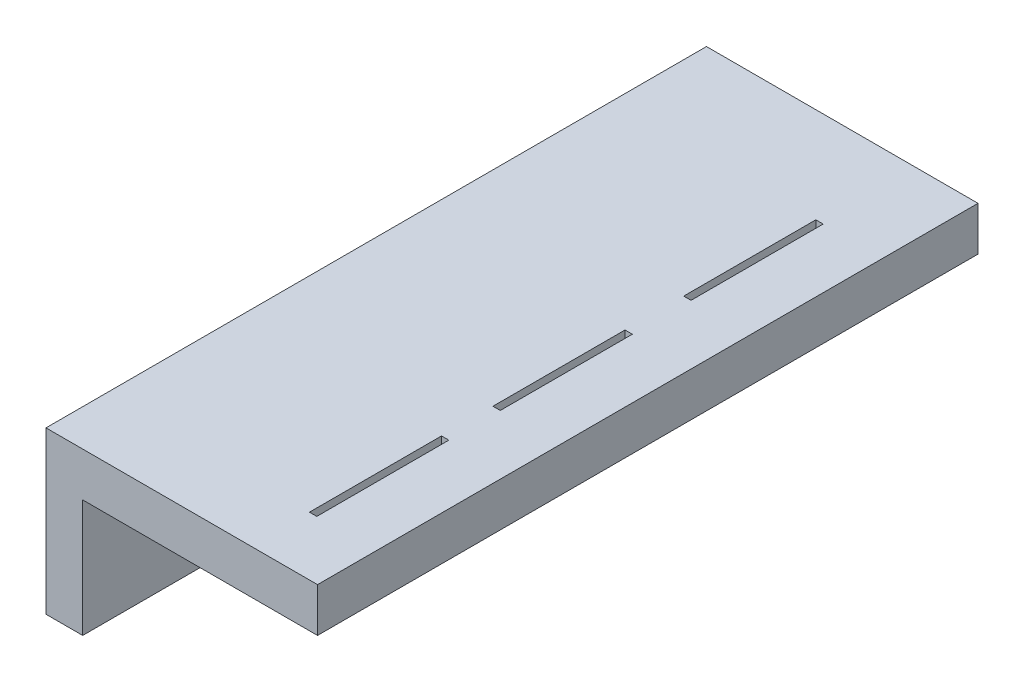
from build123d import *

# Parameters (mm, degrees)
SKETCH1_W               = 70.4
SKETCH1_H               = 2
BOSS_EXTRUDE2_DEPTH     = 10
SKETCH2_W               = 2
SKETCH2_H               = 55
BOSS_EXTRUDE3_DEPTH     = 10
SKETCH3_W               = 19
SKETCH3_H               = 3
BOSS_EXTRUDE4_DEPTH     = 2
SKETCH4_W               = 15
SKETCH4_H               = 10
CUT_EXTRUDE2_DEPTH      = 2
SKETCH5_W               = 2
SKETCH5_H               = 3
BOSS_EXTRUDE5_DEPTH     = 1
SKETCH6_W               = 2
SKETCH6_H               = 3
BOSS_EXTRUDE6_DEPTH     = 1
SKETCH7_W               = 57
SKETCH7_H               = 2
BOSS_EXTRUDE7_DEPTH     = 6.6
SKETCH8_W               = 57
SKETCH8_H               = 2
BOSS_EXTRUDE8_DEPTH     = 6.6
BOSS_EXTRUDE9_DEPTH     = 5
SKETCH12_W              = 2
SKETCH12_H              = 5
SKETCH12_H_2            = 40
SKETCH12_H_3            = 30
BOSS_EXTRUDE10_DEPTH    = 20
BOSS_EXTRUDE11_DEPTH    = 3
SKETCH14_W              = 0.5
SKETCH14_H              = 9
CUT_EXTRUDE3_DEPTH      = 3
SKETCH15_W              = 38.4
SKETCH15_H              = 45
CUT_EXTRUDE4_DEPTH      = 3
BOSS_EXTRUDE12_DEPTH    = 0.5
SKETCH17_R              = 1.8
SKETCH17_W              = 3
SKETCH17_H              = 5
CUT_EXTRUDE6_DEPTH      = 3
CUT_EXTRUDE8_DEPTH      = 32
CUT_EXTRUDE8_DEPTH_BACK = 49
SKETCH19_W              = 94.558020587
SKETCH19_H              = 51.225034616
CUT_EXTRUDE9_DEPTH      = 93
CUT_EXTRUDE9_DEPTH_BACK = 18
SKETCH20_W              = 91.945359737
SKETCH20_H              = 40.424662202
SKETCH21_W              = 45
SKETCH21_H              = 3
BOSS_EXTRUDE14_DEPTH    = 2.5
SKETCH22_W              = 2.5
SKETCH22_H              = 45
BOSS_EXTRUDE15_DEPTH    = 8
SKETCH23_R              = 1.8
CUT_EXTRUDE10_DEPTH     = 10


with BuildPart() as part:
    # Sketch1 → Boss-Extrude2 (new body)
    with BuildSketch(Plane(origin=(0, 0, 0), x_dir=(1, 0, 0), z_dir=(0, 1, 0))):
        with Locations((35.2, 1)):
            Rectangle(SKETCH1_W, SKETCH1_H)
    extrude(amount=BOSS_EXTRUDE2_DEPTH)

    # Sketch2 → Boss-Extrude3 (add)
    with BuildSketch(Plane(origin=(0, 10, 0), x_dir=(1, 0, 0), z_dir=(0, 1, 0))):
        with Locations((1, 29.5)):
            Rectangle(SKETCH2_W, SKETCH2_H)
        with Locations((69.4, 29.5)):
            Rectangle(SKETCH2_W, SKETCH2_H)
    extrude(amount=-BOSS_EXTRUDE3_DEPTH)

    # Sketch3 → Boss-Extrude4 (add)
    with BuildSketch(Plane.XY):
        with Locations((35.2, 11.5)):
            Rectangle(SKETCH3_W, SKETCH3_H)
    extrude(amount=-BOSS_EXTRUDE4_DEPTH)

    # Sketch4 → Cut-Extrude2 (cut)
    with BuildSketch(Plane.XY):
        with Locations((35.2, 5)):
            Rectangle(SKETCH4_W, SKETCH4_H)
    extrude(amount=-CUT_EXTRUDE2_DEPTH, mode=Mode.SUBTRACT)

    # Sketch5 → Boss-Extrude5 (add)
    with BuildSketch(Plane.ZY.offset(-25.7)):
        with Locations((-1, 11.5)):
            Rectangle(SKETCH5_W, SKETCH5_H)
    extrude(amount=BOSS_EXTRUDE5_DEPTH)

    # Sketch6 → Boss-Extrude6 (add)
    with BuildSketch(Plane(origin=(44.7, 0, 0), x_dir=(0, 0, -1), z_dir=(1, 0, 0))):
        with Locations((1, 11.5)):
            Rectangle(SKETCH6_W, SKETCH6_H)
    extrude(amount=BOSS_EXTRUDE6_DEPTH)

    # Sketch7 → Boss-Extrude7 (add)
    with BuildSketch(Plane.ZY):
        with Locations((-28.5, 1)):
            Rectangle(SKETCH7_W, SKETCH7_H)
    extrude(amount=BOSS_EXTRUDE7_DEPTH)

    # Sketch8 → Boss-Extrude8 (add)
    with BuildSketch(Plane(origin=(70.4, 0, 0), x_dir=(0, 0, -1), z_dir=(1, 0, 0))):
        with Locations((28.5, 1)):
            Rectangle(SKETCH8_W, SKETCH8_H)
    extrude(amount=BOSS_EXTRUDE8_DEPTH)

    # Sketch10 → Boss-Extrude9 (add)
    with BuildSketch(Plane(origin=(0, 0, -57), x_dir=(-1, 0, 0), z_dir=(0, 0, -1))):
        Polygon((-2, 10), (-2, 0), (6.6, 0), (6.6, 2), (0, 2), (0, 10), align=None)
        Polygon((-77, 0), (-68.4, 0), (-68.4, 10), (-70.4, 10), (-70.4, 2), (-77, 2), align=None)
    extrude(amount=BOSS_EXTRUDE9_DEPTH)

    # Sketch12 → Boss-Extrude10 (add)
    with BuildSketch(Plane(origin=(0, 10, 0), x_dir=(1, 0, 0), z_dir=(0, 1, 0))):
        with Locations((1, 59.5)):
            Rectangle(SKETCH12_W, SKETCH12_H)
        with Locations((1, 37)):
            Rectangle(SKETCH12_W, SKETCH12_H_2)
        with Locations((69.4, 42)):
            Rectangle(SKETCH12_W, SKETCH12_H_3)
        with Locations((69.4, 59.5)):
            Rectangle(SKETCH12_W, SKETCH12_H)
    extrude(amount=BOSS_EXTRUDE10_DEPTH)

    # Sketch13 → Boss-Extrude11 (add)
    with BuildSketch(Plane(origin=(0, 30, 0), x_dir=(1, 0, 0), z_dir=(0, 1, 0))):
        Polygon((0, 17), (35.2, 17), (35.2, 27), (70.4, 27), (70.4, 62), (0, 62), align=None)
    extrude(amount=BOSS_EXTRUDE11_DEPTH)

    # Sketch14 → Cut-Extrude3 (cut)
    with BuildSketch(Plane(origin=(0, 33, 0), x_dir=(1, 0, 0), z_dir=(0, 1, 0))):
        with Locations((11.7, 51)):
            Rectangle(SKETCH14_W, SKETCH14_H)
        with Locations((11.7, 38)):
            Rectangle(SKETCH14_W, SKETCH14_H)
        with Locations((11.7, 25.5)):
            Rectangle(SKETCH14_W, SKETCH14_H)
        with Locations((58.2, 51)):
            Rectangle(SKETCH14_W, SKETCH14_H)
        with Locations((58.2, 38)):
            Rectangle(SKETCH14_W, SKETCH14_H)
    extrude(amount=-CUT_EXTRUDE3_DEPTH, mode=Mode.SUBTRACT)

    # Sketch15 → Cut-Extrude4 (cut)
    with BuildSketch(Plane(origin=(0, 33, 0), x_dir=(1, 0, 0), z_dir=(0, 1, 0))):
        with Locations((35.2, 39.5)):
            Rectangle(SKETCH15_W, SKETCH15_H)
    extrude(amount=-CUT_EXTRUDE4_DEPTH, mode=Mode.SUBTRACT)

    # Sketch16 → Boss-Extrude12 (add)
    with BuildSketch(Plane.XY):
        Polygon((-6.6, 0), (27.7, 0), (27.7, 10), (42.7, 10), (42.7, 0), (77, 0), (77, 2), (70.4, 2), (70.4, 10), (45.7, 10), (45.7, 13), (24.7, 13), (24.7, 10), (0, 10), (0, 2), (-6.6, 2), align=None)
    extrude(amount=BOSS_EXTRUDE12_DEPTH)

    # Sketch17 → Cut-Extrude6 (cut)
    with BuildSketch(Plane(origin=(0, 2, 0), x_dir=(1, 0, 0), z_dir=(0, 1, 0))):
        with Locations(Location((-3.3, 55, 0), (0, 0, 270))):
            Circle(SKETCH17_R)
        with Locations(Location((73.7, 55, 0), (0, 0, 270))):
            Circle(SKETCH17_R)
        with Locations(Location((-3.3, 6.5, 0), (0, 0, 270))):
            Circle(SKETCH17_R)
        with Locations(Location((73.7, 6.5, 0), (0, 0, 270))):
            Circle(SKETCH17_R)
        with Locations(Location((-3.3, 30.75, 0), (0, 0, 270))):
            Circle(SKETCH17_R)
        with Locations(Location((73.7, 30.75, 0), (0, 0, 270))):
            Circle(SKETCH17_R)
        with Locations((-3.3, 14.5)):
            Rectangle(SKETCH17_W, SKETCH17_H)
        with Locations((73.7, 14.5)):
            Rectangle(SKETCH17_W, SKETCH17_H)
    extrude(amount=-CUT_EXTRUDE6_DEPTH, mode=Mode.SUBTRACT)

    # Sketch19 → Cut-Extrude8 (cut, two sides: drawn at the far end of the back side and taken through both)
    with BuildSketch(Plane(origin=(70.4, 0, 0), x_dir=(0, 0, -1), z_dir=(1, 0, 0)).offset(-CUT_EXTRUDE8_DEPTH_BACK)):
        with Locations((14.720989707, 7.387482692)):
            Rectangle(SKETCH19_W, SKETCH19_H)
    extrude(amount=CUT_EXTRUDE8_DEPTH + CUT_EXTRUDE8_DEPTH_BACK, mode=Mode.SUBTRACT)

    # Sketch20 → Cut-Extrude9 (cut, two sides: drawn at the far end of the back side and taken through both)
    with BuildSketch(Plane(origin=(2, 0, 0), x_dir=(0, 0, -1), z_dir=(1, 0, 0)).offset(-CUT_EXTRUDE9_DEPTH_BACK)):
        with Locations((16.027320132, 9.787668899)):
            Rectangle(SKETCH20_W, SKETCH20_H)
    extrude(amount=CUT_EXTRUDE9_DEPTH + CUT_EXTRUDE9_DEPTH_BACK, mode=Mode.SUBTRACT)

    # Sketch21 → Boss-Extrude14 (add)
    with BuildSketch(Plane.ZY):
        with Locations((-39.5, 31.5)):
            Rectangle(SKETCH21_W, SKETCH21_H)
    extrude(amount=BOSS_EXTRUDE14_DEPTH)

    # Sketch22 → Boss-Extrude15 (add)
    with BuildSketch(Plane.XZ.offset(-30)):
        with Locations((-1.25, -39.5)):
            Rectangle(SKETCH22_W, SKETCH22_H)
    extrude(amount=BOSS_EXTRUDE15_DEPTH)

    # Sketch23 → Cut-Extrude10 (cut)
    with BuildSketch(Plane(origin=(0, 0, 0), x_dir=(0, 0, -1), z_dir=(1, 0, 0))):
        with Locations((27, 26)):
            Circle(SKETCH23_R)
        with Locations((52, 26)):
            Circle(SKETCH23_R)
    extrude(amount=-CUT_EXTRUDE10_DEPTH, mode=Mode.SUBTRACT)


solid = part.part
